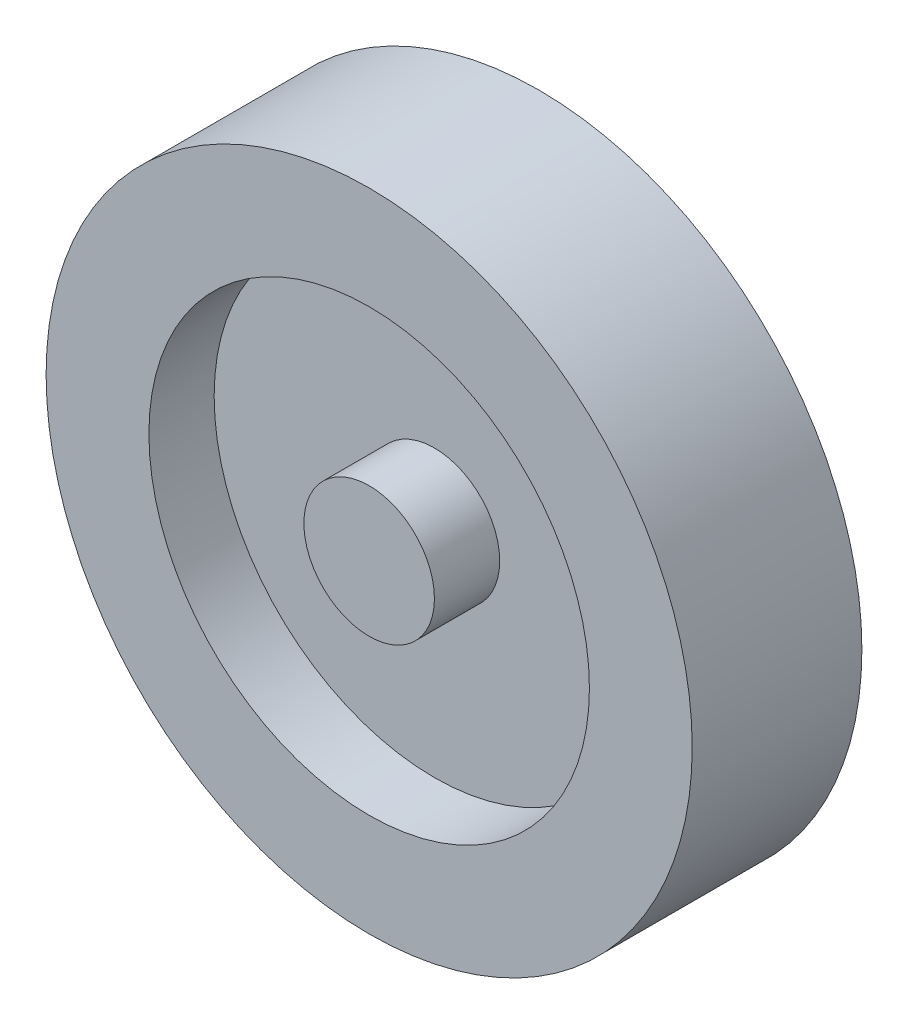
from build123d import *

# Parameters (mm, degrees)
ESQUISSE1_R             = 49.5
BOSS_EXTRU_2_DEPTH      = 13
ESQUISSE5_R             = 33.75
ESQUISSE5_R_2           = 10
ENL_V_MAT_EXTRU_1_DEPTH = 10
ESQUISSE12_R            = 10
BOSS_EXTRU_3_DEPTH      = 18.5
ESQUISSE13_R            = 3
ENL_V_MAT_EXTRU_2_DEPTH = 10


with BuildPart() as part:
    # Esquisse1 → Boss.-Extru.2 (new body)
    with BuildSketch(Plane.XY):
        with Locations(Location((0, 0, 0), (0, 0, 180))):
            Circle(ESQUISSE1_R)
    extrude(amount=BOSS_EXTRU_2_DEPTH)

    # Esquisse5 → Enlèv. mat.-Extru.1 (cut)
    with BuildSketch(Plane.XY.offset(13)):
        Circle(ESQUISSE5_R)
        Circle(ESQUISSE5_R_2, mode=Mode.SUBTRACT)
    extrude(amount=-ENL_V_MAT_EXTRU_1_DEPTH, mode=Mode.SUBTRACT)

    # Symétrie6: part across plane


with BuildPart() as part_1:
    add(part.part)
    add(part.part.mirror(Plane.XY))

    # Esquisse12 → Boss.-Extru.3 (add)
    with BuildSketch(Plane(origin=(0, 0, -13), x_dir=(-1, 0, 0), z_dir=(0, 0, -1))):
        with Locations(Location((0, 0, 0), (0, 0, 180))):
            Circle(ESQUISSE12_R)
    extrude(amount=BOSS_EXTRU_3_DEPTH)

    # Esquisse13 → Enlèv. mat.-Extru.2 (cut)
    with BuildSketch(Plane(origin=(0, 0, -31.5), x_dir=(-1, 0, 0), z_dir=(0, 0, -1))):
        Circle(ESQUISSE13_R)
    extrude(amount=-ENL_V_MAT_EXTRU_2_DEPTH, mode=Mode.SUBTRACT)


solid = part_1.part
